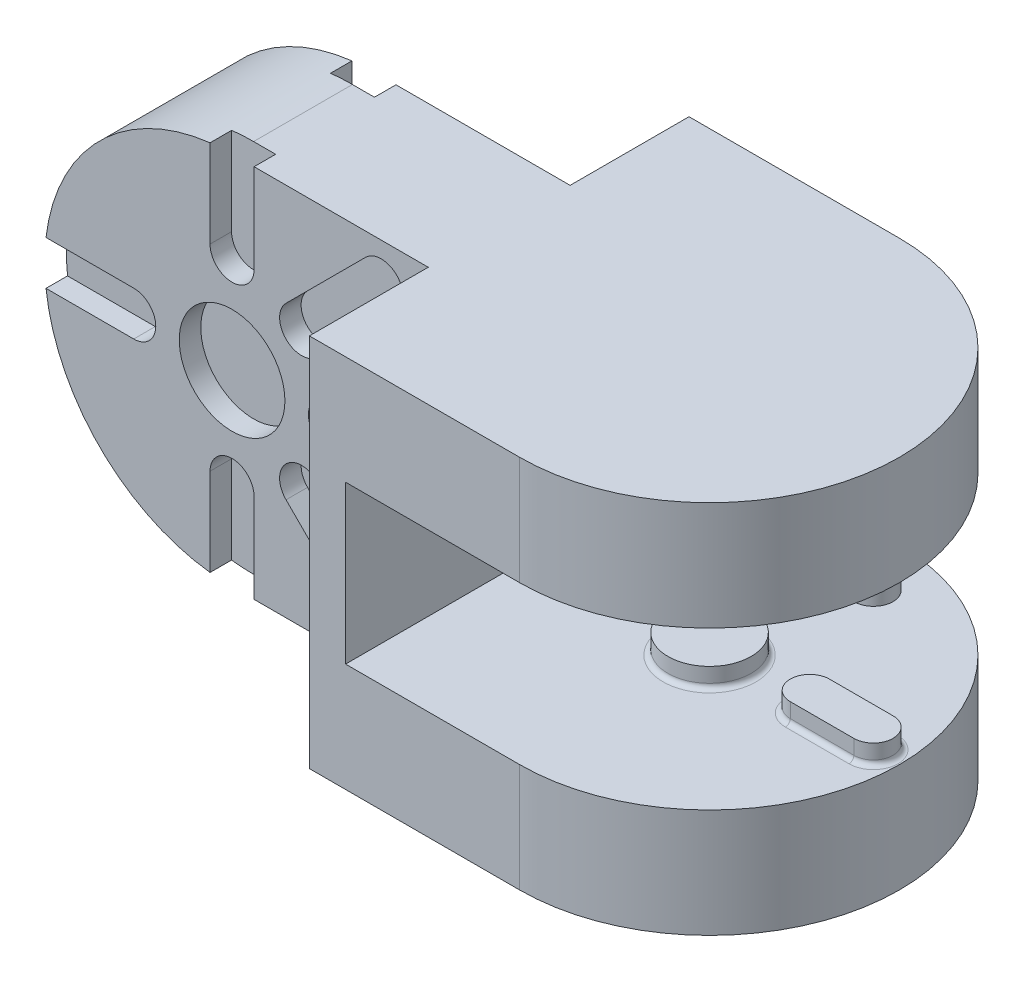
from build123d import *

# Parameters (mm, degrees)
SKETCH1_W               = 9.9568
SKETCH1_H               = 9.7282
BOSS_EXTRUDE1_DEPTH     = 1.8415
FILLET1_RADIUS          = 4.8641
FILLET1_LENGTH          = 3.683
SKETCH2_R               = 1.3716
CUT_EXTRUDE1_DEPTH      = 0.5588
CIRPATTERN1_COUNT       = 4
CUT_EXTRUDE2_DEPTH      = 0.5588
CIRPATTERN2_COUNT       = 2
CIRPATTERN2_ANGLE       = 270
MIRROR1_COPY_1_SKETCH_R = 1.3716
MIRROR1_COPY_1_DEPTH    = 0.5588
MIRROR1_COPY_2_SKETCH_R = 1.3716
MIRROR1_COPY_2_DEPTH    = 0.5588
MIRROR1_COPY_3_SKETCH_R = 1.3716
MIRROR1_COPY_3_DEPTH    = 0.5588
MIRROR1_COPY_4_DEPTH    = 0.5588
SKETCH5_W               = 9.8552
SKETCH5_H               = 9.7282
BOSS_EXTRUDE2_DEPTH     = 10.3886
SKETCH6_W               = 9.4488
SKETCH6_H               = 4.0894
CUT_EXTRUDE3_DEPTH      = 16.123076599
FILLET3_RADIUS          = 4.9276
FILLET3_LENGTH          = 2.8194
FILLET4_RADIUS          = 4.9276
FILLET4_LENGTH          = 2.8194
SKETCH7_R               = 1.0795
BOSS_EXTRUDE3_DEPTH     = 0.508
FILLET5_R               = 0.127
FILLET6_R               = 0.127


with BuildPart() as part:
    # Sketch1 → Boss-Extrude1 (new, symmetric)
    with BuildSketch(Plane.XY):
        with Locations((-4.9784, 0)):
            Rectangle(SKETCH1_W, SKETCH1_H)
    extrude(amount=BOSS_EXTRUDE1_DEPTH, both=True)

    # Fillet1: full round fillet: the end face becomes a half cylinder, R = half its width
    fillet1_face = Plane((-9.9568, 0, 0), x_dir=(0, 0, 1), z_dir=(-1, 0, 0))  # on the end face: x along it, z out of the body
    fillet1_slab = fillet1_face.offset(-FILLET1_RADIUS / 2) * Box(FILLET1_LENGTH, 2 * FILLET1_RADIUS, FILLET1_RADIUS, mode=Mode.PRIVATE)  # the body's end, R deep
    fillet1_round = Plane((-5.0927, 0, 0), x_dir=(-1, 0, 0), z_dir=(0, 0, 1)) * Cylinder(FILLET1_RADIUS, FILLET1_LENGTH, mode=Mode.PRIVATE)  # its axis R under the face
    add(fillet1_slab - fillet1_round, mode=Mode.SUBTRACT)

    # Sketch2 → Cut-Extrude1 (cut)
    with BuildSketch(Plane.XY.offset(1.8415)):
        with Locations((-5.0927, 0)):
            Circle(SKETCH2_R)
        with BuildLine():
            Line((-5.6642, 2.5527), (-5.6642, 5.4737))
            ThreePointArc((-5.6642, 5.4737), (-5.0927, 6.0452), (-4.5212, 5.4737))
            Line((-4.5212, 5.4737), (-4.5212, 2.5527))
            ThreePointArc((-4.5212, 2.5527), (-5.0927, 1.9812), (-5.6642, 2.5527))
        make_face()
    cut_extrude1 = extrude(amount=-CUT_EXTRUDE1_DEPTH, mode=Mode.SUBTRACT)

    # CirPattern1: Cut-Extrude1 ×4 about axis
    cirpattern1_axis = Axis((-5.0927, 0, 0), (0, 0, 1))
    for i in range(1, CIRPATTERN1_COUNT):
        add(cut_extrude1.rotate(cirpattern1_axis, i * 360 / CIRPATTERN1_COUNT), mode=Mode.SUBTRACT)

    # Sketch4 → Cut-Extrude2 (cut)
    with BuildSketch(Plane.XY.offset(1.8415)):
        with BuildLine():
            Line((-3.691780045, 2.209143006), (-1.626321137, 4.274601914))
            ThreePointArc((-1.626321137, 4.274601914), (-0.818098086, 4.274601914), (-0.818098086, 3.466378863))
            Line((-0.818098086, 3.466378863), (-2.883556994, 1.400919955))
            ThreePointArc((-2.883556994, 1.400919955), (-3.691780045, 1.400919955), (-3.691780045, 2.209143006))
        make_face()
    cut_extrude2 = extrude(amount=-CUT_EXTRUDE2_DEPTH, mode=Mode.SUBTRACT)

    # CirPattern2: Cut-Extrude2 ×2 about axis
    cirpattern2_axis = Axis((-5.0927, 0, 0), (0, 0, 1))
    for i in range(1, CIRPATTERN2_COUNT):
        add(cut_extrude2.rotate(cirpattern2_axis, i * CIRPATTERN2_ANGLE / (CIRPATTERN2_COUNT - 1)), mode=Mode.SUBTRACT)

    # Mirror1: Cut-Extrude1, Cut-Extrude2 across plane
    add(cut_extrude1.mirror(Plane.XY), mode=Mode.SUBTRACT)
    add(cut_extrude2.mirror(Plane.XY), mode=Mode.SUBTRACT)

    # Mirror1 copy 1 sketch → Mirror1 copy 1 (cut)
    with BuildSketch(Plane(origin=(-5.0927, 5.0927, -1.8415), x_dir=(0, 1, 0), z_dir=(0, 0, -1))):
        with Locations((-5.0927, 0)):
            Circle(MIRROR1_COPY_1_SKETCH_R)
        with BuildLine():
            Line((-5.6642, -2.5527), (-5.6642, -5.4737))
            ThreePointArc((-5.6642, -5.4737), (-5.0927, -6.0452), (-4.5212, -5.4737))
            Line((-4.5212, -5.4737), (-4.5212, -2.5527))
            ThreePointArc((-4.5212, -2.5527), (-5.0927, -1.9812), (-5.6642, -2.5527))
        make_face()
    extrude(amount=-MIRROR1_COPY_1_DEPTH, mode=Mode.SUBTRACT)

    # Mirror1 copy 2 sketch → Mirror1 copy 2 (cut)
    with BuildSketch(Plane(origin=(-10.1854, 0, -1.8415), x_dir=(-1, 0, 0), z_dir=(0, 0, -1))):
        with Locations((-5.0927, 0)):
            Circle(MIRROR1_COPY_2_SKETCH_R)
        with BuildLine():
            Line((-5.6642, -2.5527), (-5.6642, -5.4737))
            ThreePointArc((-5.6642, -5.4737), (-5.0927, -6.0452), (-4.5212, -5.4737))
            Line((-4.5212, -5.4737), (-4.5212, -2.5527))
            ThreePointArc((-4.5212, -2.5527), (-5.0927, -1.9812), (-5.6642, -2.5527))
        make_face()
    extrude(amount=-MIRROR1_COPY_2_DEPTH, mode=Mode.SUBTRACT)

    # Mirror1 copy 3 sketch → Mirror1 copy 3 (cut)
    with BuildSketch(Plane(origin=(-5.0927, -5.0927, -1.8415), x_dir=(0, -1, 0), z_dir=(0, 0, -1))):
        with Locations((-5.0927, 0)):
            Circle(MIRROR1_COPY_3_SKETCH_R)
        with BuildLine():
            Line((-5.6642, -2.5527), (-5.6642, -5.4737))
            ThreePointArc((-5.6642, -5.4737), (-5.0927, -6.0452), (-4.5212, -5.4737))
            Line((-4.5212, -5.4737), (-4.5212, -2.5527))
            ThreePointArc((-4.5212, -2.5527), (-5.0927, -1.9812), (-5.6642, -2.5527))
        make_face()
    extrude(amount=-MIRROR1_COPY_3_DEPTH, mode=Mode.SUBTRACT)

    # Mirror1 copy 4 sketch → Mirror1 copy 4 (cut)
    with BuildSketch(Plane(origin=(-5.0927, -5.0927, -1.8415), x_dir=(0, -1, 0), z_dir=(0, 0, -1))):
        with BuildLine():
            Line((-3.691780045, -2.209143006), (-1.626321137, -4.274601914))
            ThreePointArc((-1.626321137, -4.274601914), (-0.818098086, -4.274601914), (-0.818098086, -3.466378863))
            Line((-0.818098086, -3.466378863), (-2.883556994, -1.400919955))
            ThreePointArc((-2.883556994, -1.400919955), (-3.691780045, -1.400919955), (-3.691780045, -2.209143006))
        make_face()
    extrude(amount=-MIRROR1_COPY_4_DEPTH, mode=Mode.SUBTRACT)

    # Sketch5 → Boss-Extrude2 (add)
    with BuildSketch(Plane(origin=(0, 0, 0), x_dir=(0, 0, -1), z_dir=(1, 0, 0))):
        Rectangle(SKETCH5_W, SKETCH5_H)
    extrude(amount=BOSS_EXTRUDE2_DEPTH)

    # Sketch6 → Cut-Extrude3 (cut, through all)
    with BuildSketch(Plane.XY.offset(4.9276)):
        with Locations((5.6642, 0)):
            Rectangle(SKETCH6_W, SKETCH6_H)
    extrude(amount=-CUT_EXTRUDE3_DEPTH, mode=Mode.SUBTRACT)

    # Fillet3: full round fillet: the end face becomes a half cylinder, R = half its width
    fillet3_face = Plane((10.3886, 3.4544, 0), x_dir=(0, -1, 0), z_dir=(1, 0, 0))  # on the end face: x along it, z out of the body
    fillet3_slab = fillet3_face.offset(-FILLET3_RADIUS / 2) * Box(FILLET3_LENGTH, 2 * FILLET3_RADIUS, FILLET3_RADIUS, mode=Mode.PRIVATE)  # the body's end, R deep
    fillet3_round = Plane((5.461, 3.4544, 0), x_dir=(1, 0, 0), z_dir=(0, -1, 0)) * Cylinder(FILLET3_RADIUS, FILLET3_LENGTH, mode=Mode.PRIVATE)  # its axis R under the face
    add(fillet3_slab - fillet3_round, mode=Mode.SUBTRACT)

    # Fillet4: full round fillet: the end face becomes a half cylinder, R = half its width
    fillet4_face = Plane((10.3886, -3.4544, 0), x_dir=(0, 1, 0), z_dir=(1, 0, 0))  # on the end face: x along it, z out of the body
    fillet4_slab = fillet4_face.offset(-FILLET4_RADIUS / 2) * Box(FILLET4_LENGTH, 2 * FILLET4_RADIUS, FILLET4_RADIUS, mode=Mode.PRIVATE)  # the body's end, R deep
    fillet4_round = Plane((5.461, -3.4544, 0), x_dir=(1, 0, 0), z_dir=(0, 1, 0)) * Cylinder(FILLET4_RADIUS, FILLET4_LENGTH, mode=Mode.PRIVATE)  # its axis R under the face
    add(fillet4_slab - fillet4_round, mode=Mode.SUBTRACT)

    # Sketch7 → Boss-Extrude3 (add)
    with BuildSketch(Plane.XZ.offset(-2.0447)):
        with Locations(Location((5.461, 0, 0), (0, 0, 90))):
            Circle(SKETCH7_R)
        with BuildLine():
            Line((8.0645, 0.508), (9.7155, 0.508))
            ThreePointArc((9.7155, 0.508), (10.2235, 0), (9.7155, -0.508))
            Line((9.7155, -0.508), (8.0645, -0.508))
            ThreePointArc((8.0645, -0.508), (7.5565, 0), (8.0645, 0.508))
        make_face()
    boss_extrude3 = extrude(amount=BOSS_EXTRUDE3_DEPTH)

    # Fillet5
    fillet5_edges = [part.edges().sort_by_distance(p)[0] for p in [
        (5.461, 2.0447, -1.0795),
        (7.5565, 2.0447, 0),
        (8.89, 2.0447, -0.508),
        (10.2235, 2.0447, 0),
        (8.89, 2.0447, 0.508),
    ]]
    fillet(fillet5_edges, radius=FILLET5_R)

    # Mirror3: Boss-Extrude3 across plane
    add(boss_extrude3.mirror(Plane.ZX))

    # Fillet6
    fillet6_edges = [part.edges().sort_by_distance(p)[0] for p in [
        (5.461, -2.0447, -1.0795),
        (7.5565, -2.0447, 0),
        (8.89, -2.0447, -0.508),
        (10.2235, -2.0447, 0),
        (8.89, -2.0447, 0.508),
    ]]
    fillet(fillet6_edges, radius=FILLET6_R)


solid = part.part
